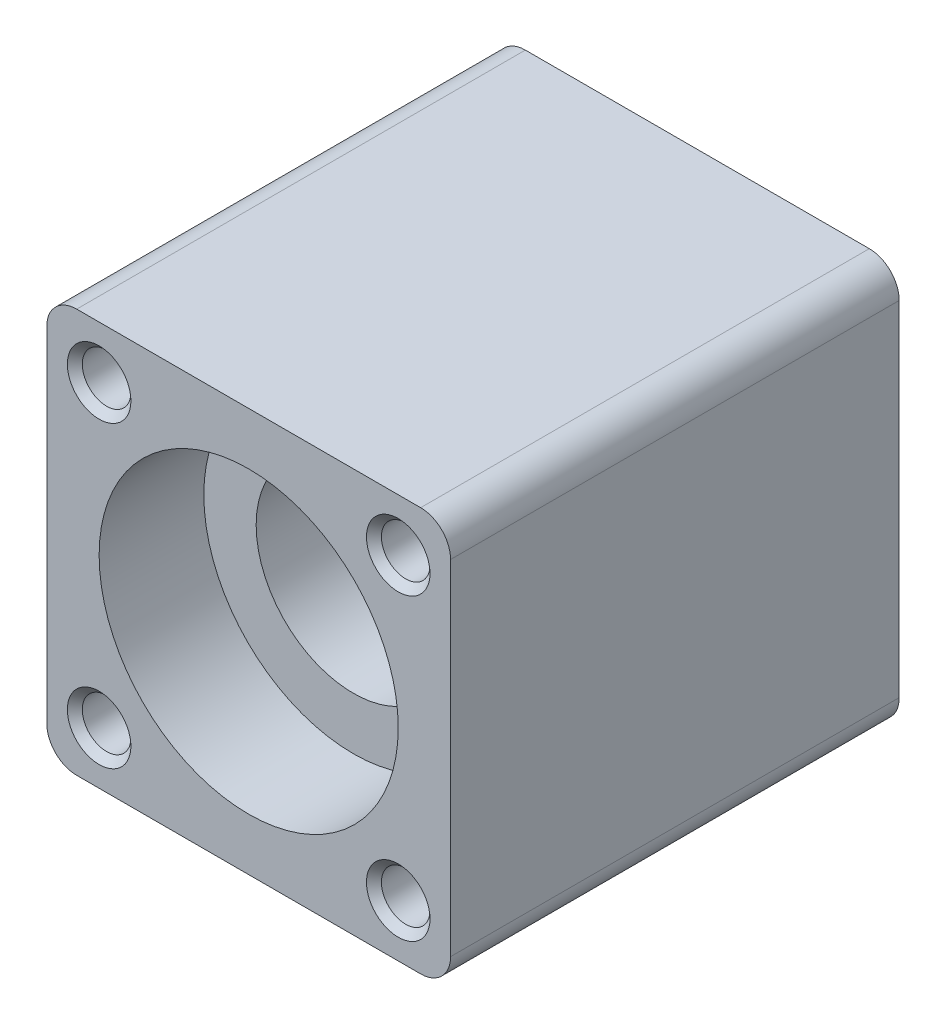
from build123d import *

# Parameters (mm, degrees)
CROQUIS1_W              = 54
CROQUIS1_H              = 54
SALIENTE_EXTRUIR1_DEPTH = 60
CROQUIS2_R              = 13
CORTAR_EXTRUIR1_DEPTH   = 72.119617547
CROQUIS3_R              = 20
CORTAR_EXTRUIR2_DEPTH   = 14
CORTAR_EXTRUIR3_START   = -12
CROQUIS4_R              = 20
CORTAR_EXTRUIR3_DEPTH   = 12
CROQUIS5_R              = 3.25
CORTAR_EXTRUIR4_DEPTH   = 72.119617547
REDONDEO1_R             = 4
CHAFL_N1_SIZE           = 1


with BuildPart() as part:
    # Croquis1 → Saliente-Extruir1 (new body)
    with BuildSketch(Plane.XY):
        Rectangle(CROQUIS1_W, CROQUIS1_H)
    extrude(amount=SALIENTE_EXTRUIR1_DEPTH)

    # Croquis2 → Cortar-Extruir1 (cut, through all)
    with BuildSketch(Plane.XY.offset(60)):
        Circle(CROQUIS2_R)
    extrude(amount=-CORTAR_EXTRUIR1_DEPTH, mode=Mode.SUBTRACT)

    # Croquis3 → Cortar-Extruir2 (cut)
    with BuildSketch(Plane.XY.offset(60)):
        Circle(CROQUIS3_R)
    extrude(amount=-CORTAR_EXTRUIR2_DEPTH, mode=Mode.SUBTRACT)

    # Croquis4 → Cortar-Extruir3 (cut)
    with BuildSketch(Plane(origin=(0, 0, 0), x_dir=(-1, 0, 0), z_dir=(0, 0, -1)).offset(CORTAR_EXTRUIR3_START)):
        with Locations(Location((0, 0, 0), (0, 0, 180))):
            Circle(CROQUIS4_R)
    extrude(amount=CORTAR_EXTRUIR3_DEPTH, mode=Mode.SUBTRACT)

    # Croquis5 → Cortar-Extruir4 (cut, through all)
    with BuildSketch(Plane.XY.offset(60)):
        with Locations((20, 20)):
            Circle(CROQUIS5_R)
        with Locations((20, -20)):
            Circle(CROQUIS5_R)
        with Locations((-20, -20)):
            Circle(CROQUIS5_R)
        with Locations((-20, 20)):
            Circle(CROQUIS5_R)
    extrude(amount=-CORTAR_EXTRUIR4_DEPTH, mode=Mode.SUBTRACT)

    # Redondeo1
    redondeo1_edges = [part.edges().sort_by_distance(p)[0] for p in [
        (27, -27, 30),
        (-27, -27, 30),
        (-27, 27, 30),
        (27, 27, 30),
    ]]
    fillet(redondeo1_edges, radius=REDONDEO1_R)

    # Chaflán1
    chafl_n1_edges = [part.edges().sort_by_distance(p)[0] for p in [
        (16.75, 20, 60),
        (16.75, -20, 60),
        (-23.25, -20, 60),
        (-23.25, 20, 60),
    ]]
    chamfer(chafl_n1_edges, length=CHAFL_N1_SIZE)


solid = part.part
